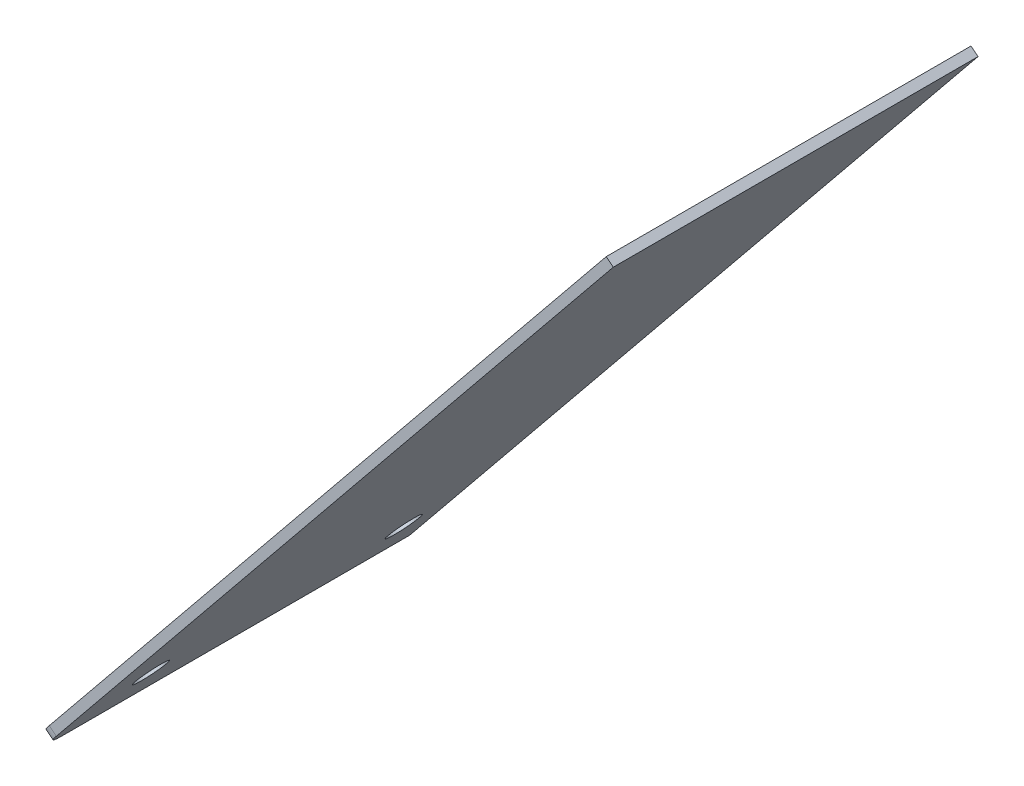
from build123d import *

# Parameters (mm, degrees)
BOSS_EXTRUDE1_DEPTH = 256.54
CUT_EXTRUDE1_REACH  = 759.98
SKETCH2_R           = 11.1125
FILLET1_R           = 12.7


with BuildPart() as part:
    # Sketch1 → Boss-Extrude1 (new body)
    with BuildSketch(Plane.XY):
        Polygon((-112.549019073, -7.182145107), (-117.475, -3.175), (-517.267555835, -494.639734243), (-512.341574908, -498.646879349), align=None)
    extrude(amount=BOSS_EXTRUDE1_DEPTH)

    # Sketch2 → Cut-Extrude1 (cut, up to next)
    with BuildSketch(Plane(origin=(-69.139884972, 56.243326117, 0), x_dir=(0, 0, 1), z_dir=(-0.77574502790219, 0.6310464734748387, 0)), mode=Mode.PRIVATE) as cut_extrude1_sk1:
        with Locations(Location((36.195, -659.334181394, 0), (0, 0, 270))):
            Circle(SKETCH2_R)
    cut_extrude1_tool1 = extrude(cut_extrude1_sk1.sketch, amount=-CUT_EXTRUDE1_REACH, mode=Mode.PRIVATE) & part.part
    # Sketch2 → Cut-Extrude1 (cut, up to next)
    with BuildSketch(Plane(origin=(-69.139884972, 56.243326117, 0), x_dir=(0, 0, 1), z_dir=(-0.77574502790219, 0.6310464734748387, 0)), mode=Mode.PRIVATE) as cut_extrude1_sk2:
        with Locations(Location((213.995, -659.334181394, 0), (0, 0, 270))):
            Circle(SKETCH2_R)
    cut_extrude1_tool2 = extrude(cut_extrude1_sk2.sketch, amount=-CUT_EXTRUDE1_REACH, mode=Mode.PRIVATE) & part.part
    add(cut_extrude1_tool1.solids().sort_by_distance((-485.210395, -455.231887, 36.195))[0], mode=Mode.SUBTRACT)
    add(cut_extrude1_tool2.solids().sort_by_distance((-485.210395, -455.231887, 213.995))[0], mode=Mode.SUBTRACT)

    # Fillet1
    fillet1_edges = [part.edges().sort_by_distance(p)[0] for p in [
        (-514.804565371, -496.643306796, 256.54),
    ]]
    fillet(fillet1_edges, radius=FILLET1_R)


solid = part.part
